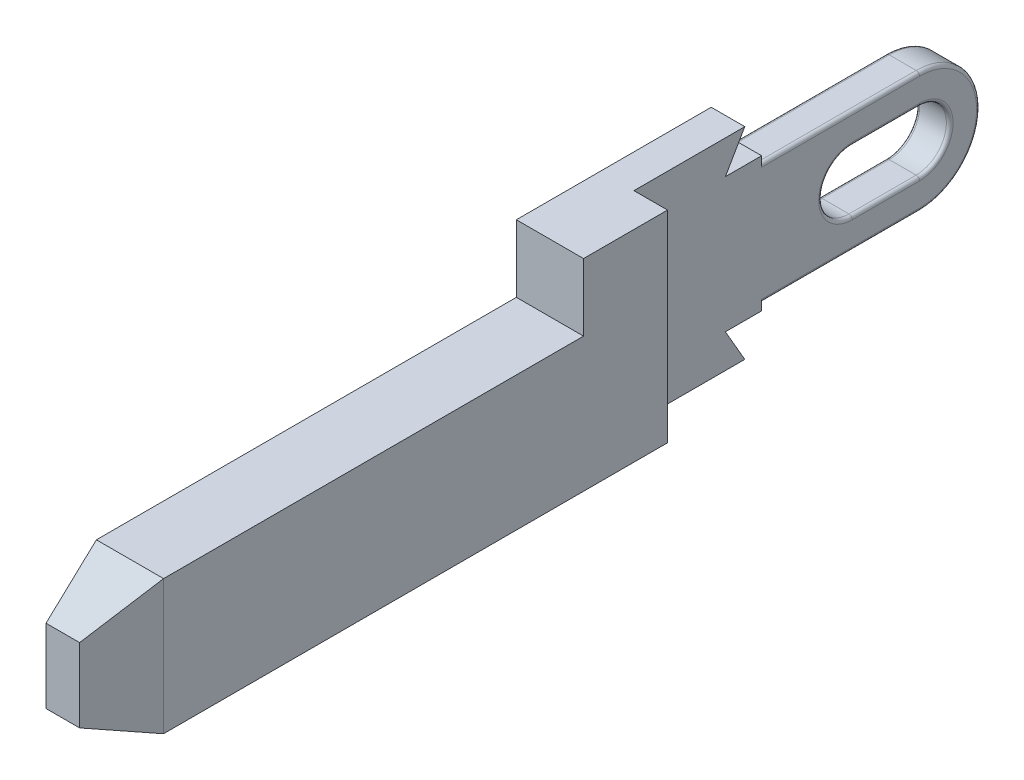
from build123d import *

# Parameters (mm, degrees)
EXTRUDE_1_DEPTH     = 2
SKETCH_2_W          = 12.24406528
SKETCH_2_H          = 8.971692278
CUT_EXTRUDE_1_DEPTH = 1
CHAMFER_1_SIZE      = 0.5
CHAMFER_1_SIZE2     = 2
CHAMFER_2_SIZE      = 2
CHAMFER_2_SIZE2     = 0.5
FILLET_1_R          = 0.1


with BuildPart() as part:
    # Эскиз1 → Бобышка-Вытянуть1 (new body)
    with BuildSketch(Plane(origin=(0, 0, 0), x_dir=(0, 0, -1), z_dir=(1, 0, 0))):
        with BuildLine():
            Line((0, 0), (0, 1.1))
            Line((0, 1.1), (2, 2))
            Line((2, 2), (14.5, 2))
            Line((14.5, 2), (14.5, 4))
            Line((14.5, 4), (20.3, 4))
            Line((20.3, 4), (19.722649731, 3))
            Line((19.722649731, 3), (20.8, 3))
            Line((20.8, 3), (20.8, 2.8))
            Line((20.8, 2.8), (25.5, 2.8))
            ThreePointArc((25.5, 2.8), (27.3, 1), (25.5, -0.8))
            Line((25.5, -0.8), (20.8, -0.8))
            Line((20.8, -0.8), (20.8, -1))
            Line((20.8, -1), (19.722649731, -1))
            Line((19.722649731, -1), (20.3, -2))
            Line((20.3, -2), (2, -2))
            Line((2, -2), (0, -1.1))
            Line((0, -1.1), (0, 0))
        make_face()
        with BuildLine():
            Line((23.5, 1.9), (25.5, 1.9))
            ThreePointArc((25.5, 1.9), (26.4, 1), (25.5, 0.1))
            Line((25.5, 0.1), (23.5, 0.1))
            ThreePointArc((23.5, 0.1), (22.6, 1), (23.5, 1.9))
        make_face(mode=Mode.SUBTRACT)
    extrude(amount=EXTRUDE_1_DEPTH)

    # Эскиз2 → Вырез-Вытянуть1 (cut)
    with BuildSketch(Plane(origin=(2, 0, 0), x_dir=(0, 0, -1), z_dir=(1, 0, 0))):
        with Locations((23.12203264, 1.144281601)):
            Rectangle(SKETCH_2_W, SKETCH_2_H)
    extrude(amount=-CUT_EXTRUDE_1_DEPTH, mode=Mode.SUBTRACT)

    # Фаска1
    chamfer_1_edges = [part.edges().sort_by_distance(p)[0] for p in [
        (2, 0, 0),
    ]]
    chamfer_1_side = [part.faces().sort_by_distance(p)[0] for p in [
        (1, 0, 0),
    ]]
    chamfer(chamfer_1_edges, length=CHAMFER_1_SIZE, length2=CHAMFER_1_SIZE2, reference=chamfer_1_side[0])

    # Фаска2
    chamfer_2_edges = [part.edges().sort_by_distance(p)[0] for p in [
        (0, 0, 0),
    ]]
    chamfer_2_side = [part.faces().sort_by_distance(p)[0] for p in [
        (0, 0.481010429, -13.197583299),
    ]]
    chamfer(chamfer_2_edges, length=CHAMFER_2_SIZE, length2=CHAMFER_2_SIZE2, reference=chamfer_2_side[0])

    # Скругление1
    fillet_1_edges = [part.edges().sort_by_distance(p)[0] for p in [
        (0, 2.8, -23.15),
        (0, 1, -27.3),
        (0, -0.8, -23.15),
        (0, 1, -22.6),
        (0, 0.1, -24.5),
        (0, 1, -26.4),
        (0, 1.9, -24.5),
        (1, 1.9, -24.5),
        (1, 1, -22.6),
        (1, 0.1, -24.5),
        (1, 1, -26.4),
        (1, -0.8, -23.15),
        (1, 1, -27.3),
        (1, 2.8, -23.15),
    ]]
    fillet(fillet_1_edges, radius=FILLET_1_R)


solid = part.part
